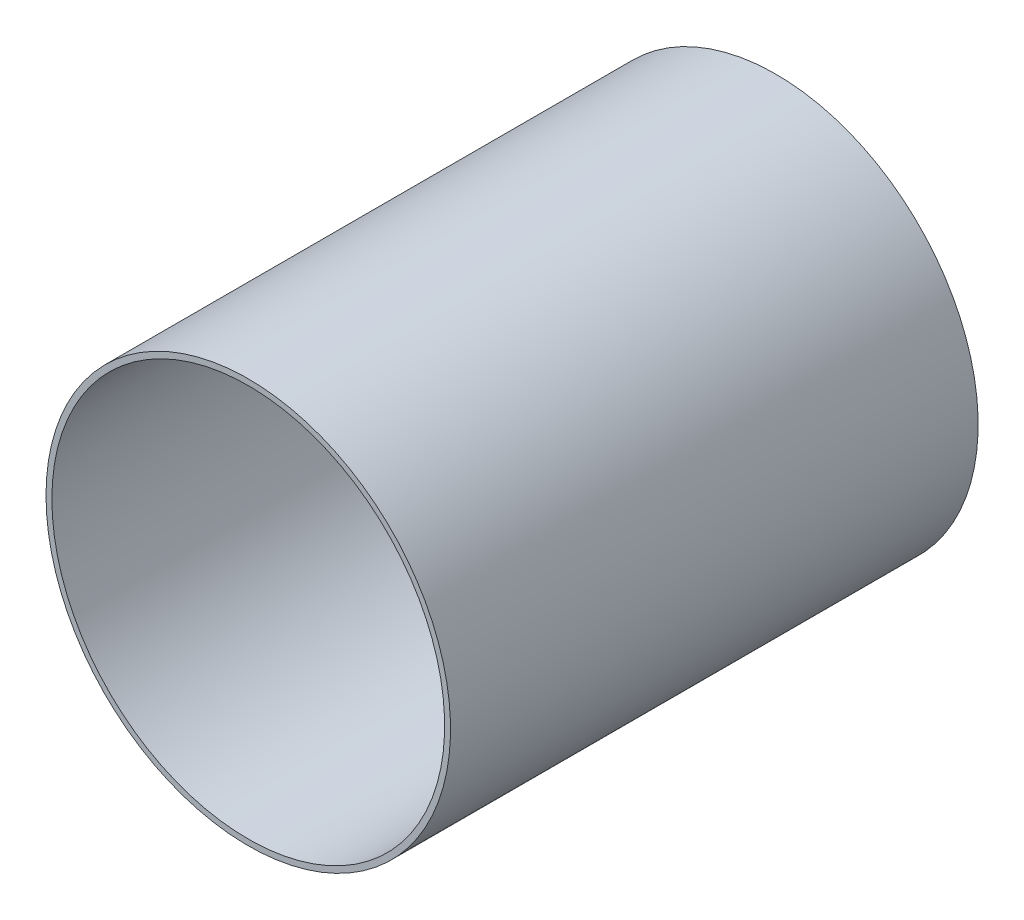
from build123d import *

# Parameters (mm, degrees)
IZIM1_R                     = 34.5
IZIM1_R_2                   = 33.5
Y_KSEKLIK_EKSTR_ZYON2_DEPTH = 90


with BuildPart() as part:
    # Çizim1 → Yükseklik-Ekstrüzyon2 (new body)
    with BuildSketch(Plane.XY):
        with Locations(Location((0, 0, 0), (0, 0, 180))):
            Circle(IZIM1_R)
        with Locations(Location((0, 0, 0), (0, 0, 180))):
            Circle(IZIM1_R_2, mode=Mode.SUBTRACT)
    extrude(amount=Y_KSEKLIK_EKSTR_ZYON2_DEPTH)


solid = part.part
